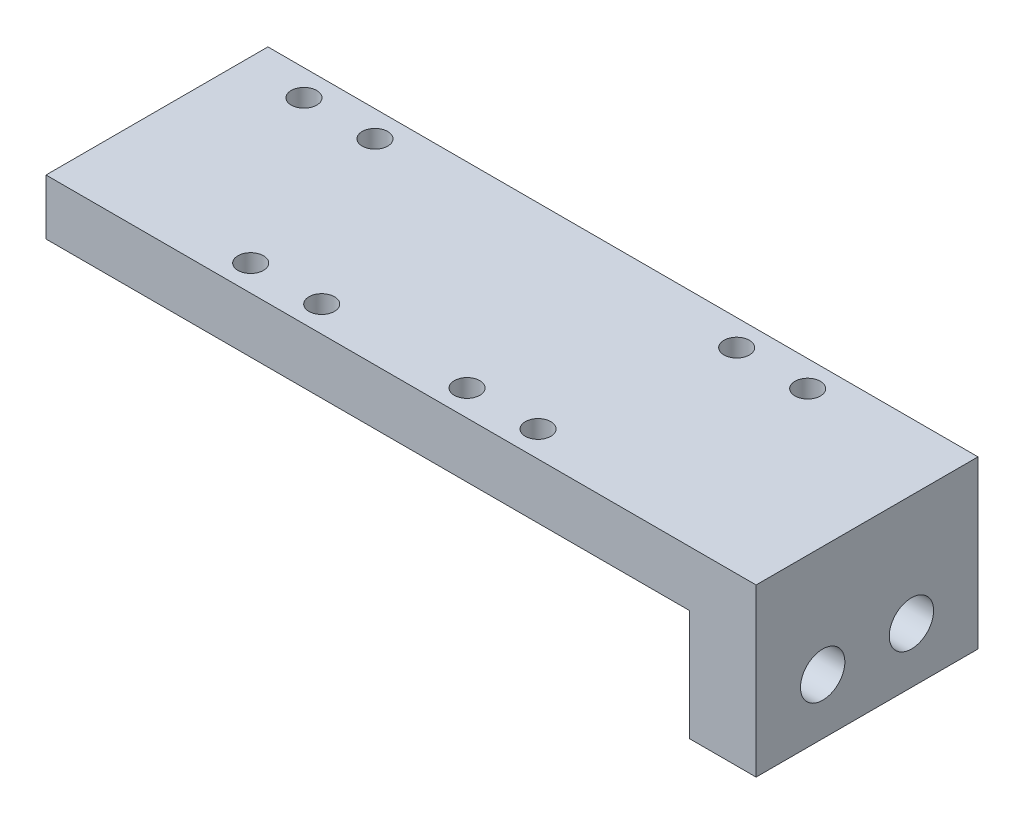
from build123d import *

# Parameters (mm, degrees)
RESSALTO_EXTRUS_O1_DEPTH   = 10
ESBO_O2_R                  = 2
CORTE_EXTRUS_O1_DEPTH      = 8
CORTE_EXTRUS_O2_DEPTH      = 61.737138556
CORTE_EXTRUS_O2_DEPTH_BACK = 61.737138556
ESBO_O3_R                  = 1.15


with BuildPart() as part:
    # Esboço1 → Ressalto-extrusão1 (new, symmetric)
    with BuildSketch(Plane.XY):
        Polygon((0, 0), (0, 10), (-58, 10), (-58, 15), (6, 15), (6, 0), align=None)
    extrude(amount=RESSALTO_EXTRUS_O1_DEPTH, both=True)

    # Esboço2 → Corte-extrusão1 (cut)
    with BuildSketch(Plane.ZY):
        with Locations(Location((-4, 5, 0), (0, 0, 270))):
            Circle(ESBO_O2_R)
        with Locations(Location((4, 5, 0), (0, 0, 270))):
            Circle(ESBO_O2_R)
    extrude(amount=-CORTE_EXTRUS_O1_DEPTH, mode=Mode.SUBTRACT)

    # Esboço3 → Corte-extrusão2 (cut, two sides: drawn at the far end of the back side and taken through both)
    with BuildSketch(Plane(origin=(0, 15, 0), x_dir=(1, 0, 0), z_dir=(0, 1, 0)).offset(-CORTE_EXTRUS_O2_DEPTH_BACK)):
        with Locations(Location((-16, -7.65, 0), (0, 0, 180))):
            Circle(ESBO_O3_R)
        with Locations(Location((-22.4, -7.65, 0), (0, 0, 180))):
            Circle(ESBO_O3_R)
        with Locations(Location((-35.5, -7.65, 0), (0, 0, 180))):
            Circle(ESBO_O3_R)
        with Locations(Location((-41.9, -7.65, 0), (0, 0, 180))):
            Circle(ESBO_O3_R)
        with Locations(Location((-46, 7.65, 0), (0, 0, 180))):
            Circle(ESBO_O3_R)
        with Locations(Location((-52.4, 7.65, 0), (0, 0, 180))):
            Circle(ESBO_O3_R)
        with Locations(Location((-13.4, 7.65, 0), (0, 0, 180))):
            Circle(ESBO_O3_R)
        with Locations(Location((-7, 7.65, 0), (0, 0, 180))):
            Circle(ESBO_O3_R)
    extrude(amount=CORTE_EXTRUS_O2_DEPTH + CORTE_EXTRUS_O2_DEPTH_BACK, mode=Mode.SUBTRACT)


solid = part.part
